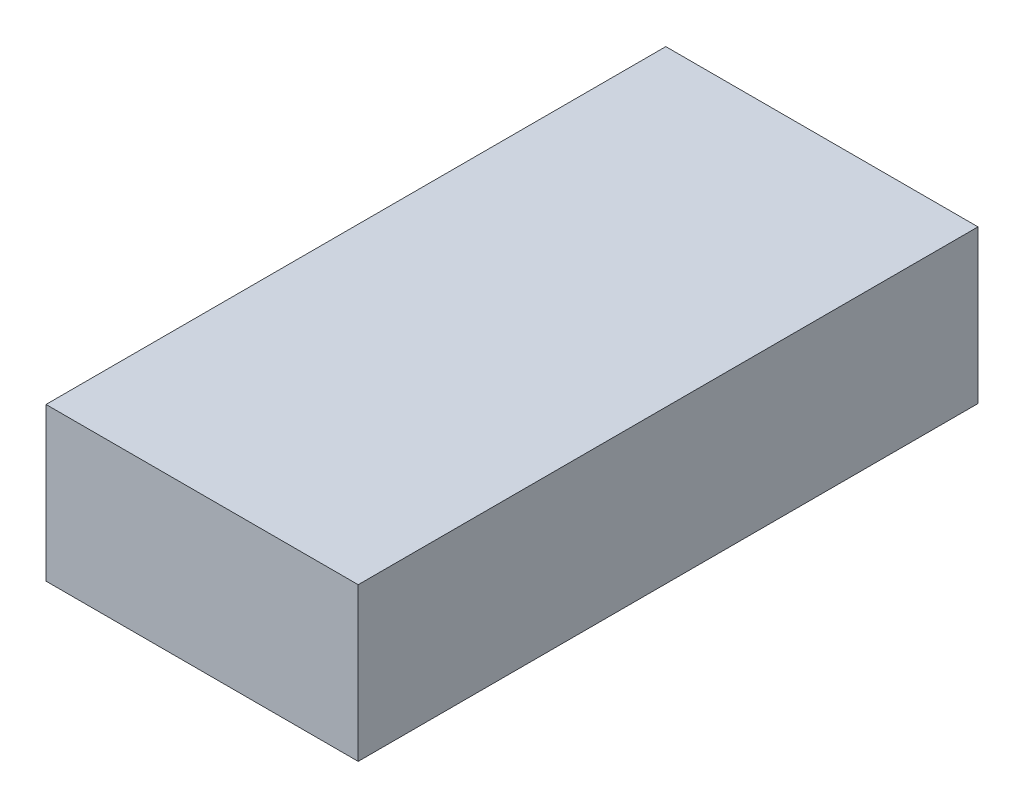
from build123d import *

# Parameters (mm, degrees)
SKETCH2_W           = 25.908
SKETCH2_H           = 51.435
BOSS_EXTRUDE1_DEPTH = 6.35


with BuildPart() as part:
    # Sketch2 → Boss-Extrude1 (new, symmetric)
    with BuildSketch(Plane(origin=(0, 0, 0), x_dir=(1, 0, 0), z_dir=(0, 1, 0))):
        Rectangle(SKETCH2_W, SKETCH2_H)
    extrude(amount=BOSS_EXTRUDE1_DEPTH, both=True)


solid = part.part
